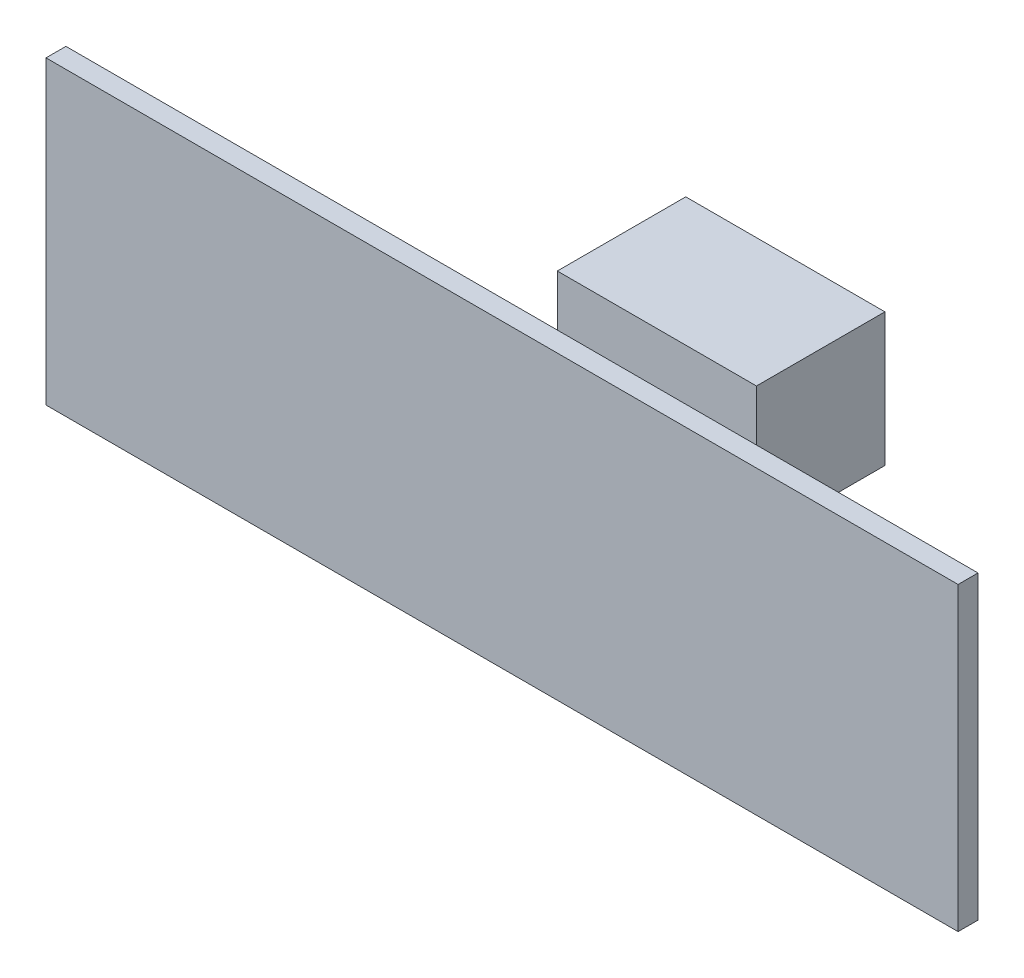
from build123d import *

# Parameters (mm, degrees)
SKETCH2_W                = 116.326794342
SKETCH2_H                = 38.349309978
OUT_IN_Z_DIRECTION_DEPTH = 2.54
SKETCH3_W                = 16.381902108
SKETCH3_H                = 16.980023094
AT_ORIGIN_DEPTH          = 12.7


with BuildPart() as part:
    # Sketch2 → out in z direction (new body)
    with BuildSketch(Plane.XY.offset(25.4)):
        Rectangle(SKETCH2_W, SKETCH2_H)
    extrude(amount=OUT_IN_Z_DIRECTION_DEPTH)


with BuildPart() as body_2:
    # Sketch3 → at origin (new, symmetric)
    with BuildSketch(Plane(origin=(0, 0, 0), x_dir=(0, 0, -1), z_dir=(1, 0, 0))):
        Rectangle(SKETCH3_W, SKETCH3_H)
    extrude(amount=AT_ORIGIN_DEPTH, both=True)


solid = Compound([part.part, body_2.part])
